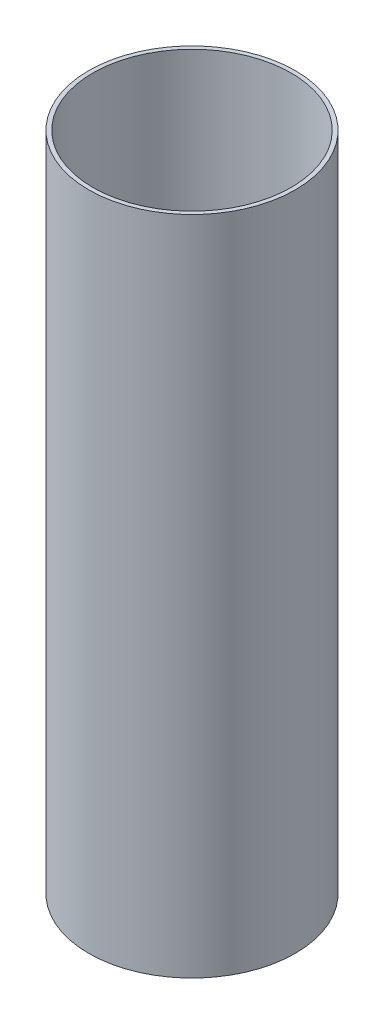
from build123d import *

# Parameters (mm, degrees)
SKETCH1_R           = 39.6748
SKETCH1_R_2         = 38.1
BOSS_EXTRUDE1_DEPTH = 127


with BuildPart() as part:
    # Sketch1 → Boss-Extrude1 (new, symmetric)
    with BuildSketch(Plane(origin=(0, 0, 0), x_dir=(1, 0, 0), z_dir=(0, 1, 0))):
        with Locations(Location((0, 0, 0), (0, 0, 270))):
            Circle(SKETCH1_R)
        with Locations(Location((0, 0, 0), (0, 0, 270))):
            Circle(SKETCH1_R_2, mode=Mode.SUBTRACT)
    extrude(amount=BOSS_EXTRUDE1_DEPTH, both=True)


solid = part.part
